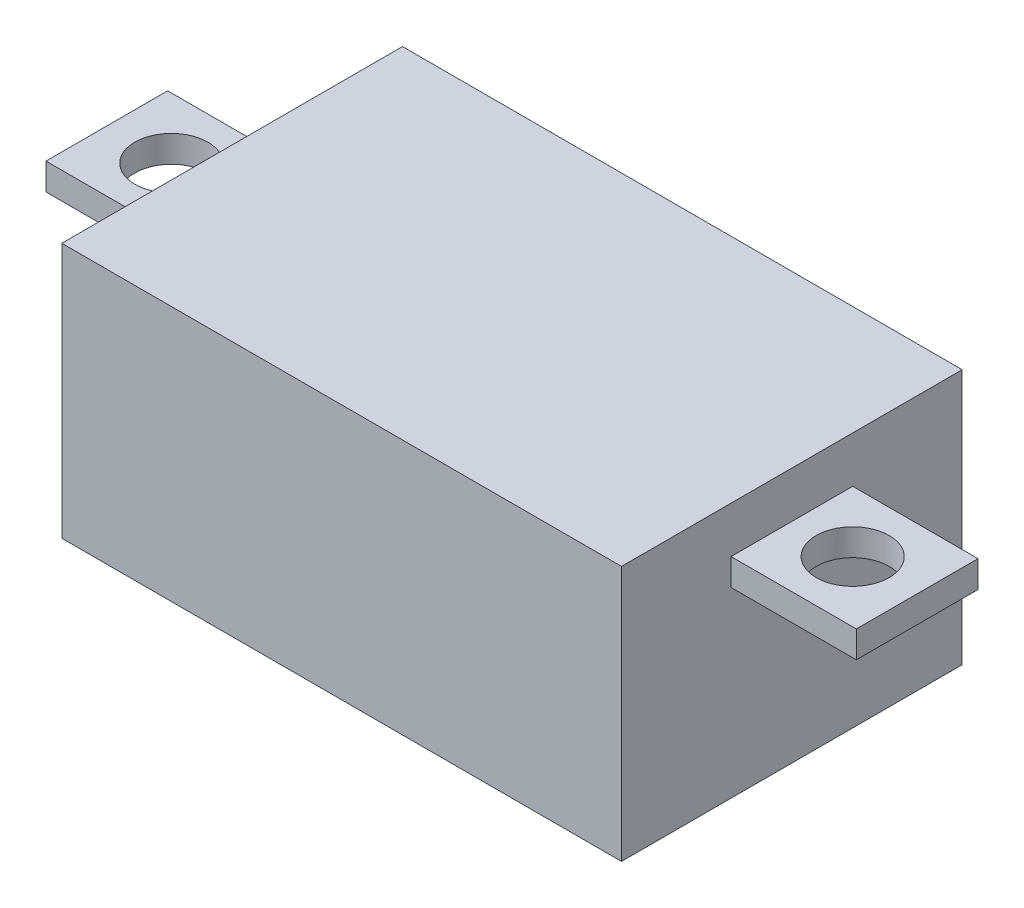
from build123d import *

# Parameters (mm, degrees)
SKETCH1_W           = 23
SKETCH1_H           = 5
SKETCH1_H_2         = 4.5
BOSS_EXTRUDE1_DEPTH = 3
SKETCH1_3_W         = 5.15
SKETCH1_3_H         = 5
BOSS_EXTRUDE2_DEPTH = 1.1
SKETCH1_4_W         = 23
SKETCH1_4_H         = 4.5
SKETCH1_4_H_2       = 5
BOSS_EXTRUDE3_DEPTH = 7.5
CUT_EXTRUDE1_DEPTH  = 0.1
SKETCH3_R           = 0.75
BOSS_EXTRUDE4_DEPTH = 3
SKETCH4_R           = 1.5
CUT_EXTRUDE2_DEPTH  = 3


with BuildPart() as part:
    # Sketch1 → Boss-Extrude1 (new body)
    with BuildSketch(Plane(origin=(0, 0, 0), x_dir=(1, 0, 0), z_dir=(0, 1, 0))):
        Rectangle(SKETCH1_W, SKETCH1_H)
        with Locations((0, 4.75)):
            Rectangle(SKETCH1_W, SKETCH1_H_2)
        with Locations((0, -4.75)):
            Rectangle(SKETCH1_W, SKETCH1_H_2)
    extrude(amount=BOSS_EXTRUDE1_DEPTH)

    # Sketch1<3> → Boss-Extrude2 (add)
    with BuildSketch(Plane(origin=(0, 0, 0), x_dir=(1, 0, 0), z_dir=(0, 1, 0))):
        with Locations((-14.075, 0)):
            Rectangle(SKETCH1_3_W, SKETCH1_3_H)
        with Locations((14.075, 0)):
            Rectangle(SKETCH1_3_W, SKETCH1_3_H)
    extrude(amount=BOSS_EXTRUDE2_DEPTH)

    # Sketch1<4> → Boss-Extrude3 (add)
    with BuildSketch(Plane(origin=(0, 0, 0), x_dir=(1, 0, 0), z_dir=(0, 1, 0))):
        with Locations((0, 4.75)):
            Rectangle(SKETCH1_4_W, SKETCH1_4_H)
        Rectangle(SKETCH1_4_W, SKETCH1_4_H_2)
        with Locations((0, -4.75)):
            Rectangle(SKETCH1_4_W, SKETCH1_4_H)
    extrude(amount=-BOSS_EXTRUDE3_DEPTH)

    # Sketch2 → Cut-Extrude1 (cut)
    # profile 1 of 6: a face of its own
    with BuildSketch(Plane.XZ.offset(7.5)):
        with BuildLine():
            add(Edge.make_bspline(
                [(-9.292089882, 0.353910669), (-9.369966013, 0.418740361), (-9.523854163, 0.546847925), (-9.726005835, 0.768331915), (-9.894228996, 1.014337533), (-10.034938928, 1.281771944), (-10.141747182, 1.57347794), (-10.216215029, 1.88822002), (-10.263993349, 2.225824651), (-10.268607907, 2.459260528), (-10.270985986, 2.579560019)],
                knots=[0, 0, 0, 0, 0.962321305, 1.901607647, 2.838895944, 3.787827236, 4.766613298, 5.782633764, 6.857296347, 8, 8, 8, 8], degree=3))
            add(Edge.make_bspline(
                [(-10.270985986, 2.579560019), (-10.268752451, 2.677092318), (-10.264306852, 2.871219344), (-10.225007942, 3.160813926), (-10.168050446, 3.447821175), (-10.084685938, 3.731316518), (-9.975826887, 4.010807629), (-9.845231621, 4.288206544), (-9.687278834, 4.560976048), (-9.512624597, 4.829289299), (-9.317660862, 5.081544377), (-9.095375456, 5.300124741), (-8.854960944, 5.487655154), (-8.594740858, 5.64083173), (-8.314904661, 5.760138762), (-8.015691699, 5.841163516), (-7.697392905, 5.894484769), (-7.478191122, 5.900396619), (-7.365953518, 5.903423656)],
                knots=[0, 0, 0, 0, 0.95272502, 1.896291562, 2.851490125, 3.810370635, 4.779693931, 5.780320533, 6.803581294, 7.857439095, 8.908007786, 9.912055773, 10.895812754, 11.88078429, 12.854673399, 13.859316582, 14.903908662, 16, 16, 16, 16], degree=3))
            add(Edge.make_bspline(
                [(-7.365953518, 5.903423656), (-7.268424733, 5.901310819), (-7.07661239, 5.89715545), (-6.796555544, 5.857824646), (-6.530844527, 5.791306852), (-6.278993715, 5.7004596), (-6.038253428, 5.587756922), (-5.816157777, 5.440585665), (-5.605711134, 5.272819807), (-5.411152916, 5.079760257), (-5.234518689, 4.867264296), (-5.080026687, 4.637247126), (-4.950691729, 4.391174638), (-4.84159923, 4.130343567), (-4.764305613, 3.850653711), (-4.700938952, 3.558449997), (-4.668099435, 3.249137224), (-4.66313761, 3.03822803), (-4.660596375, 2.93020937)],
                knots=[0, 0, 0, 0, 1.036327342, 2.038171339, 2.998737472, 3.943083592, 4.880902852, 5.81669551, 6.768071647, 7.73820126, 8.724768468, 9.701170866, 10.677725755, 11.675996246, 12.700037544, 13.757698046, 14.851588941, 16, 16, 16, 16], degree=3))
            add(Edge.make_bspline(
                [(-4.660596375, 2.93020937), (-4.665470786, 2.780489587), (-4.674976547, 2.488515702), (-4.757324951, 2.063537964), (-4.89447939, 1.667296122), (-5.082530207, 1.297130247), (-5.328381699, 0.960936756), (-5.630684816, 0.661021941), (-5.986032054, 0.39490834), (-6.254142647, 0.255235492), (-6.391927544, 0.183456123)],
                knots=[0, 0, 0, 0, 1.043187573, 2.034357272, 3.004410992, 3.958635752, 4.918549635, 5.894987737, 6.918211712, 8, 8, 8, 8], degree=3))
            add(Edge.make_bspline(
                [(-6.391927544, 0.183456123), (-6.285937579, 0.104779005), (-6.081203282, -0.047196744), (-5.816885683, -0.309430836), (-5.593790941, -0.581435195), (-5.421552611, -0.875078918), (-5.287488757, -1.185580691), (-5.196036753, -1.520885566), (-5.139141593, -1.879536562), (-5.131858792, -2.127200615), (-5.128128843, -2.254043877)],
                knots=[0, 0, 0, 0, 1.103169462, 2.130924592, 3.10674262, 4.038553697, 4.969572418, 5.928607489, 6.939118624, 8, 8, 8, 8], degree=3))
            add(Edge.make_bspline(
                [(-5.128128843, -2.254043877), (-5.130355964, -2.403550426), (-5.134725946, -2.696907156), (-5.186050384, -3.125704286), (-5.262085668, -3.534190074), (-5.372461008, -3.92127166), (-5.513332249, -4.287705959), (-5.686932358, -4.632833952), (-5.89237694, -4.955990461), (-6.127617552, -5.253654803), (-6.384886287, -5.522044868), (-6.654122961, -5.760601127), (-6.939615466, -5.958623163), (-7.235521083, -6.124238977), (-7.546402361, -6.251408264), (-7.87020702, -6.340615142), (-8.206289822, -6.400276635), (-8.435497858, -6.405575347), (-8.551830142, -6.408264656)],
                knots=[0, 0, 0, 0, 1.19522445, 2.345229263, 3.449174291, 4.51575633, 5.559872245, 6.584797786, 7.600593968, 8.617592793, 9.614055066, 10.571096483, 11.489641328, 12.387604148, 13.278569105, 14.168587384, 15.070484547, 16, 16, 16, 16], degree=3))
            add(Edge.make_bspline(
                [(-8.551830142, -6.408264656), (-8.649370913, -6.405324924), (-8.841286195, -6.399540887), (-9.123176641, -6.357766295), (-9.392318373, -6.286556224), (-9.650536122, -6.18844771), (-9.897256434, -6.062279141), (-10.129533278, -5.903368994), (-10.351789984, -5.721386358), (-10.558415405, -5.511115257), (-10.746653273, -5.280059081), (-10.911989362, -5.028988124), (-11.049658856, -4.760591697), (-11.166322714, -4.476127145), (-11.252281165, -4.173526876), (-11.315568599, -3.855173241), (-11.355948105, -3.520501425), (-11.359884116, -3.291498911), (-11.361895077, -3.174498422)],
                knots=[0, 0, 0, 0, 0.976828073, 1.921947418, 2.846812991, 3.760316856, 4.683895112, 5.615170581, 6.573899456, 7.556966719, 8.56260179, 9.554771102, 10.562015217, 11.579574908, 12.629331345, 13.707172389, 14.82856329, 16, 16, 16, 16], degree=3))
            add(Edge.make_bspline(
                [(-11.361895077, -3.174498422), (-11.358893619, -3.031461926), (-11.352937357, -2.747612272), (-11.297032141, -2.328974804), (-11.210495445, -1.921892631), (-11.086330829, -1.533962239), (-10.937672241, -1.172477772), (-10.769387226, -0.846264631), (-10.585879547, -0.559575103), (-10.380228347, -0.312658624), (-10.148392525, -0.101660076), (-9.890372792, 0.079766689), (-9.604184289, 0.236926715), (-9.397917662, 0.314242697), (-9.292089882, 0.353910669)],
                knots=[0, 0, 0, 0, 1.176834195, 2.335375853, 3.470249067, 4.598613457, 5.683040259, 6.684117428, 7.61626911, 8.479421649, 9.321209342, 10.188772394, 11.070726076, 12, 12, 12, 12], degree=3))
        make_face()
        with BuildLine():
            add(Edge.make_bspline(
                [(-9.024232739, 2.557644435), (-9.019984778, 2.424155755), (-9.011939068, 2.171325914), (-8.940523924, 1.813653337), (-8.82366826, 1.499545993), (-8.652934158, 1.235848533), (-8.445929006, 1.02189069), (-8.199893544, 0.869744979), (-7.922960018, 0.775223416), (-7.727109054, 0.765540419), (-7.626505466, 0.760566513)],
                knots=[0, 0, 0, 0, 1.249965187, 2.367455427, 3.403040823, 4.37163023, 5.291522028, 6.169698539, 7.059821352, 8, 8, 8, 8], degree=3))
            add(Edge.make_bspline(
                [(-7.626505466, 0.760566513), (-7.567129982, 0.762415457), (-7.449274454, 0.766085462), (-7.276773622, 0.796006119), (-7.110943797, 0.844298884), (-6.955081049, 0.916574072), (-6.80486254, 1.005239281), (-6.660047764, 1.111766669), (-6.527292784, 1.242912278), (-6.400165164, 1.388781357), (-6.284594653, 1.549865276), (-6.1839886, 1.72465279), (-6.098729246, 1.910584898), (-6.027887222, 2.107538902), (-5.974631047, 2.316450059), (-5.936142929, 2.536229275), (-5.910706551, 2.76727698), (-5.908482015, 2.925270332), (-5.907349622, 3.005696383)],
                knots=[0, 0, 0, 0, 0.90439548, 1.795151793, 2.660108851, 3.529301595, 4.405508313, 5.315974762, 6.260835364, 7.243018857, 8.262584836, 9.276808601, 10.311866317, 11.37615408, 12.462288436, 13.593083084, 14.774766022, 16, 16, 16, 16], degree=3))
            add(Edge.make_bspline(
                [(-5.907349622, 3.005696383), (-5.911492795, 3.138373955), (-5.919367767, 3.390555581), (-5.99277121, 3.748111205), (-6.116283359, 4.061584173), (-6.288884359, 4.327777247), (-6.496428299, 4.544788084), (-6.740411029, 4.700064922), (-7.012898579, 4.798549283), (-7.20601132, 4.807779516), (-7.305076895, 4.812514565)],
                knots=[0, 0, 0, 0, 1.242877275, 2.362349616, 3.403932345, 4.383439229, 5.319896184, 6.196053275, 7.074587107, 8, 8, 8, 8], degree=3))
            add(Edge.make_bspline(
                [(-7.305076895, 4.812514565), (-7.381744872, 4.809652479), (-7.532981132, 4.80400669), (-7.7543054, 4.745917659), (-7.966718924, 4.659206521), (-8.167822417, 4.53564359), (-8.35451273, 4.379124479), (-8.51977347, 4.185715298), (-8.670210064, 3.96306034), (-8.793447641, 3.708657074), (-8.89429768, 3.435989181), (-8.97157572, 3.152027575), (-9.015873736, 2.857749793), (-9.021425279, 2.658438029), (-9.024232739, 2.557644435)],
                knots=[0, 0, 0, 0, 0.87561259, 1.727244921, 2.601871461, 3.494031832, 4.416998155, 5.378250612, 6.395927924, 7.484363514, 8.604216258, 9.719590807, 10.846778364, 12, 12, 12, 12], degree=3))
        make_face(mode=Mode.SUBTRACT)
        with BuildLine():
            add(Edge.make_bspline(
                [(-10.11514183, -3.340082838), (-10.113718962, -3.412364525), (-10.110930355, -3.554025768), (-10.089641083, -3.762001329), (-10.049440816, -3.958479451), (-10.000173371, -4.145346884), (-9.930452741, -4.31922606), (-9.84760194, -4.483190233), (-9.750355866, -4.637000459), (-9.638448916, -4.778148602), (-9.514689571, -4.904099519), (-9.382689089, -5.014400209), (-9.242830929, -5.108670297), (-9.093101645, -5.183008521), (-8.937520854, -5.246008366), (-8.772412583, -5.285297823), (-8.600782171, -5.314894456), (-8.482976103, -5.3165232), (-8.4227717, -5.317355565)],
                knots=[0, 0, 0, 0, 1.188472519, 2.329227527, 3.431145324, 4.483453595, 5.502046191, 6.50477738, 7.500735689, 8.488703579, 9.46076844, 10.398891858, 11.313168927, 12.226373873, 13.143374327, 14.065893971, 15.011581498, 16, 16, 16, 16], degree=3))
            add(Edge.make_bspline(
                [(-8.4227717, -5.317355565), (-8.347855682, -5.314791006), (-8.199785048, -5.309722184), (-7.983629307, -5.261968453), (-7.779575528, -5.1832466), (-7.587605666, -5.073932834), (-7.405520613, -4.936785604), (-7.237038614, -4.765659218), (-7.078733545, -4.5655432), (-6.887173538, -4.259600546), (-6.681508579, -3.851096439), (-6.506489083, -3.334541329), (-6.393008715, -2.805255845), (-6.380933471, -2.446170873), (-6.37488209, -2.266219201)],
                knots=[0, 0, 0, 0, 0.666783807, 1.317890398, 1.961238708, 2.608922107, 3.280084467, 3.985816239, 4.742584327, 5.549105806, 7.198637847, 8.804205301, 10.398460966, 12, 12, 12, 12], degree=3))
            add(Edge.make_bspline(
                [(-6.37488209, -2.266219201), (-6.376173023, -2.193913756), (-6.378703058, -2.052205951), (-6.401729445, -1.8456549), (-6.434818783, -1.650024696), (-6.482757664, -1.465951776), (-6.54946261, -1.295467735), (-6.628156446, -1.136113018), (-6.717318678, -0.98566542), (-6.824704337, -0.850665593), (-6.941929739, -0.730141669), (-7.062540323, -0.619697109), (-7.19724262, -0.533752251), (-7.334406589, -0.455665244), (-7.48230974, -0.401488104), (-7.634990065, -0.358325848), (-7.796172151, -0.333945899), (-7.90646122, -0.331557238), (-7.962544427, -0.330342578)],
                knots=[0, 0, 0, 0, 1.235243386, 2.420891397, 3.54745643, 4.624155825, 5.664870234, 6.669842854, 7.659477372, 8.647360494, 9.608789992, 10.532661795, 11.432905565, 12.332935577, 13.224265291, 14.116026642, 15.041978771, 16, 16, 16, 16], degree=3))
            add(Edge.make_bspline(
                [(-7.962544427, -0.330342578), (-8.034966148, -0.332406726), (-8.177658586, -0.336473716), (-8.388098695, -0.377330005), (-8.589281695, -0.443680862), (-8.785964635, -0.531849606), (-8.972225277, -0.649708186), (-9.152003173, -0.792436914), (-9.321771935, -0.961973378), (-9.484748859, -1.152972384), (-9.632449399, -1.366634092), (-9.762045672, -1.599073831), (-9.870862051, -1.84809746), (-9.962906268, -2.113014797), (-10.028558115, -2.396677242), (-10.080918771, -2.695597088), (-10.109751133, -3.012405933), (-10.113311539, -3.228827469), (-10.11514183, -3.340082838)],
                knots=[0, 0, 0, 0, 0.845026475, 1.66495475, 2.492356661, 3.315348054, 4.175499836, 5.059354536, 5.991121003, 6.973085749, 7.988125535, 9.019370445, 10.076222338, 11.158449011, 12.289679313, 13.472558368, 14.700723345, 16, 16, 16, 16], degree=3))
        make_face(mode=Mode.SUBTRACT)
    # profile 2 of 6: a face of its own
    with BuildSketch(Plane.XZ.offset(7.5)):
        Polygon((-5.812284687, -6.2524205), (-5.551732739, -4.538134786), (-4.275758713, -4.538134786), (-4.56553144, -6.2524205), align=None)
    # profile 3 of 6: a face of its own
    with BuildSketch(Plane.XZ.offset(7.5)):
        with BuildLine():
            add(Edge.make_bspline(
                [(-1.621440531, 0.353910669), (-1.699316662, 0.418740361), (-1.853204813, 0.546847925), (-2.055356485, 0.768331915), (-2.223579645, 1.014337533), (-2.364289577, 1.281771944), (-2.471097832, 1.57347794), (-2.545565678, 1.88822002), (-2.593343998, 2.225824651), (-2.597958556, 2.459260528), (-2.600336635, 2.579560019)],
                knots=[0, 0, 0, 0, 0.962321305, 1.901607647, 2.838895944, 3.787827236, 4.766613298, 5.782633764, 6.857296347, 8, 8, 8, 8], degree=3))
            add(Edge.make_bspline(
                [(-2.600336635, 2.579560019), (-2.5981031, 2.677092318), (-2.593657501, 2.871219344), (-2.554358592, 3.160813926), (-2.497401096, 3.447821175), (-2.414036587, 3.731316518), (-2.305177536, 4.010807629), (-2.17458227, 4.288206544), (-2.016629484, 4.560976048), (-1.841975247, 4.829289299), (-1.647011511, 5.081544377), (-1.424726105, 5.300124741), (-1.184311594, 5.487655154), (-0.924091507, 5.64083173), (-0.64425531, 5.760138762), (-0.345042348, 5.841163516), (-0.026743555, 5.894484769), (0.192458229, 5.900396619), (0.304695832, 5.903423656)],
                knots=[0, 0, 0, 0, 0.95272502, 1.896291562, 2.851490125, 3.810370635, 4.779693931, 5.780320533, 6.803581294, 7.857439095, 8.908007786, 9.912055773, 10.895812754, 11.88078429, 12.854673399, 13.859316582, 14.903908662, 16, 16, 16, 16], degree=3))
            add(Edge.make_bspline(
                [(0.304695832, 5.903423656), (0.402224618, 5.901310819), (0.594036961, 5.89715545), (0.874093806, 5.857824646), (1.139804824, 5.791306852), (1.391655636, 5.7004596), (1.632395922, 5.587756922), (1.854491574, 5.440585665), (2.064938217, 5.272819807), (2.259496434, 5.079760257), (2.436130662, 4.867264296), (2.590622664, 4.637247126), (2.719957621, 4.391174638), (2.829050121, 4.130343567), (2.906343737, 3.850653711), (2.969710399, 3.558449997), (3.002549916, 3.249137224), (3.007511741, 3.03822803), (3.010052975, 2.93020937)],
                knots=[0, 0, 0, 0, 1.036327342, 2.038171339, 2.998737472, 3.943083592, 4.880902852, 5.81669551, 6.768071647, 7.73820126, 8.724768468, 9.701170866, 10.677725755, 11.675996246, 12.700037544, 13.757698046, 14.851588941, 16, 16, 16, 16], degree=3))
            add(Edge.make_bspline(
                [(3.010052975, 2.93020937), (3.005178565, 2.780489587), (2.995672804, 2.488515702), (2.9133244, 2.063537964), (2.77616996, 1.667296122), (2.588119144, 1.297130247), (2.342267652, 0.960936756), (2.039964534, 0.661021941), (1.684617297, 0.39490834), (1.416506704, 0.255235492), (1.278721806, 0.183456123)],
                knots=[0, 0, 0, 0, 1.043187573, 2.034357272, 3.004410992, 3.958635752, 4.918549635, 5.894987737, 6.918211712, 8, 8, 8, 8], degree=3))
            add(Edge.make_bspline(
                [(1.278721806, 0.183456123), (1.384711772, 0.104779005), (1.589446068, -0.047196744), (1.853763668, -0.309430836), (2.07685841, -0.581435195), (2.249096739, -0.875078918), (2.383160593, -1.185580691), (2.474612597, -1.520885566), (2.531507758, -1.879536562), (2.538790559, -2.127200615), (2.542520508, -2.254043877)],
                knots=[0, 0, 0, 0, 1.103169462, 2.130924592, 3.10674262, 4.038553697, 4.969572418, 5.928607489, 6.939118624, 8, 8, 8, 8], degree=3))
            add(Edge.make_bspline(
                [(2.542520508, -2.254043877), (2.540293387, -2.403550426), (2.535923405, -2.696907156), (2.484598967, -3.125704286), (2.408563683, -3.534190074), (2.298188342, -3.92127166), (2.157317102, -4.287705959), (1.983716992, -4.632833952), (1.778272411, -4.955990461), (1.543031799, -5.253654803), (1.285763064, -5.522044868), (1.016526389, -5.760601127), (0.731033885, -5.958623163), (0.435128268, -6.124238977), (0.12424699, -6.251408264), (-0.199557669, -6.340615142), (-0.535640471, -6.400276635), (-0.764848507, -6.405575347), (-0.881180791, -6.408264656)],
                knots=[0, 0, 0, 0, 1.19522445, 2.345229263, 3.449174291, 4.51575633, 5.559872245, 6.584797786, 7.600593968, 8.617592793, 9.614055066, 10.571096483, 11.489641328, 12.387604148, 13.278569105, 14.168587384, 15.070484547, 16, 16, 16, 16], degree=3))
            add(Edge.make_bspline(
                [(-0.881180791, -6.408264656), (-0.978721563, -6.405324924), (-1.170636844, -6.399540887), (-1.452527291, -6.357766295), (-1.721669023, -6.286556224), (-1.979886772, -6.18844771), (-2.226607084, -6.062279141), (-2.458883928, -5.903368994), (-2.681140633, -5.721386358), (-2.887766054, -5.511115257), (-3.076003923, -5.280059081), (-3.241340011, -5.028988124), (-3.379009505, -4.760591697), (-3.495673363, -4.476127145), (-3.581631814, -4.173526876), (-3.644919248, -3.855173241), (-3.685298754, -3.520501425), (-3.689234765, -3.291498911), (-3.691245726, -3.174498422)],
                knots=[0, 0, 0, 0, 0.976828073, 1.921947418, 2.846812991, 3.760316856, 4.683895112, 5.615170581, 6.573899456, 7.556966719, 8.56260179, 9.554771102, 10.562015217, 11.579574908, 12.629331345, 13.707172389, 14.82856329, 16, 16, 16, 16], degree=3))
            add(Edge.make_bspline(
                [(-3.691245726, -3.174498422), (-3.688244268, -3.031461926), (-3.682288007, -2.747612272), (-3.62638279, -2.328974804), (-3.539846095, -1.921892631), (-3.415681478, -1.533962239), (-3.26702289, -1.172477772), (-3.098737876, -0.846264631), (-2.915230197, -0.559575103), (-2.709578996, -0.312658624), (-2.477743174, -0.101660076), (-2.219723441, 0.079766689), (-1.933534938, 0.236926715), (-1.727268312, 0.314242697), (-1.621440531, 0.353910669)],
                knots=[0, 0, 0, 0, 1.176834195, 2.335375853, 3.470249067, 4.598613457, 5.683040259, 6.684117428, 7.61626911, 8.479421649, 9.321209342, 10.188772394, 11.070726076, 12, 12, 12, 12], degree=3))
        make_face()
        with BuildLine():
            add(Edge.make_bspline(
                [(-1.353583388, 2.557644435), (-1.349335428, 2.424155755), (-1.341289717, 2.171325914), (-1.269874573, 1.813653337), (-1.15301891, 1.499545993), (-0.982284808, 1.235848533), (-0.775279655, 1.02189069), (-0.529244193, 0.869744979), (-0.252310667, 0.775223416), (-0.056459704, 0.765540419), (0.044143884, 0.760566513)],
                knots=[0, 0, 0, 0, 1.249965187, 2.367455427, 3.403040823, 4.37163023, 5.291522028, 6.169698539, 7.059821352, 8, 8, 8, 8], degree=3))
            add(Edge.make_bspline(
                [(0.044143884, 0.760566513), (0.103519369, 0.762415457), (0.221374897, 0.766085462), (0.393875729, 0.796006119), (0.559705553, 0.844298884), (0.715568301, 0.916574072), (0.865786811, 1.005239281), (1.010601587, 1.111766669), (1.143356567, 1.242912278), (1.270484187, 1.388781357), (1.386054698, 1.549865276), (1.486660751, 1.72465279), (1.571920104, 1.910584898), (1.642762129, 2.107538902), (1.696018303, 2.316450059), (1.734506421, 2.536229275), (1.7599428, 2.76727698), (1.762167335, 2.925270332), (1.763299729, 3.005696383)],
                knots=[0, 0, 0, 0, 0.90439548, 1.795151793, 2.660108851, 3.529301595, 4.405508313, 5.315974762, 6.260835364, 7.243018857, 8.262584836, 9.276808601, 10.311866317, 11.37615408, 12.462288436, 13.593083084, 14.774766022, 16, 16, 16, 16], degree=3))
            add(Edge.make_bspline(
                [(1.763299729, 3.005696383), (1.759156555, 3.138373955), (1.751281584, 3.390555581), (1.677878141, 3.748111205), (1.554365991, 4.061584173), (1.381764991, 4.327777247), (1.174221052, 4.544788084), (0.930238322, 4.700064922), (0.657750772, 4.798549283), (0.464638031, 4.807779516), (0.365572456, 4.812514565)],
                knots=[0, 0, 0, 0, 1.242877275, 2.362349616, 3.403932345, 4.383439229, 5.319896184, 6.196053275, 7.074587107, 8, 8, 8, 8], degree=3))
            add(Edge.make_bspline(
                [(0.365572456, 4.812514565), (0.288904479, 4.809652479), (0.137668218, 4.80400669), (-0.083656049, 4.745917659), (-0.296069573, 4.659206521), (-0.497173067, 4.53564359), (-0.683863379, 4.379124479), (-0.84912412, 4.185715298), (-0.999560713, 3.96306034), (-1.122798291, 3.708657074), (-1.223648329, 3.435989181), (-1.300926369, 3.152027575), (-1.345224386, 2.857749793), (-1.350775928, 2.658438029), (-1.353583388, 2.557644435)],
                knots=[0, 0, 0, 0, 0.87561259, 1.727244921, 2.601871461, 3.494031832, 4.416998155, 5.378250612, 6.395927924, 7.484363514, 8.604216258, 9.719590807, 10.846778364, 12, 12, 12, 12], degree=3))
        make_face(mode=Mode.SUBTRACT)
        with BuildLine():
            add(Edge.make_bspline(
                [(-2.444492479, -3.340082838), (-2.443069612, -3.412364525), (-2.440281005, -3.554025768), (-2.418991732, -3.762001329), (-2.378791466, -3.958479451), (-2.329524021, -4.145346884), (-2.259803391, -4.31922606), (-2.176952589, -4.483190233), (-2.079706516, -4.637000459), (-1.967799565, -4.778148602), (-1.84404022, -4.904099519), (-1.712039738, -5.014400209), (-1.572181578, -5.108670297), (-1.422452295, -5.183008521), (-1.266871503, -5.246008366), (-1.101763232, -5.285297823), (-0.930132821, -5.314894456), (-0.812326752, -5.3165232), (-0.752122349, -5.317355565)],
                knots=[0, 0, 0, 0, 1.188472519, 2.329227527, 3.431145324, 4.483453595, 5.502046191, 6.50477738, 7.500735689, 8.488703579, 9.46076844, 10.398891858, 11.313168927, 12.226373873, 13.143374327, 14.065893971, 15.011581498, 16, 16, 16, 16], degree=3))
            add(Edge.make_bspline(
                [(-0.752122349, -5.317355565), (-0.677206331, -5.314791006), (-0.529135698, -5.309722184), (-0.312979957, -5.261968453), (-0.108926178, -5.1832466), (0.083043685, -5.073932834), (0.265128737, -4.936785604), (0.433610737, -4.765659218), (0.591915806, -4.5655432), (0.783475813, -4.259600546), (0.989140771, -3.851096439), (1.164160268, -3.334541329), (1.277640635, -2.805255845), (1.289715879, -2.446170873), (1.295767261, -2.266219201)],
                knots=[0, 0, 0, 0, 0.666783807, 1.317890398, 1.961238708, 2.608922107, 3.280084467, 3.985816239, 4.742584327, 5.549105806, 7.198637847, 8.804205301, 10.398460966, 12, 12, 12, 12], degree=3))
            add(Edge.make_bspline(
                [(1.295767261, -2.266219201), (1.294476328, -2.193913756), (1.291946293, -2.052205951), (1.268919905, -1.8456549), (1.235830568, -1.650024696), (1.187891687, -1.465951776), (1.121186741, -1.295467735), (1.042492905, -1.136113018), (0.953330673, -0.98566542), (0.845945014, -0.850665593), (0.728719611, -0.730141669), (0.608109027, -0.619697109), (0.473406731, -0.533752251), (0.336242761, -0.455665244), (0.188339611, -0.401488104), (0.035659286, -0.358325848), (-0.1255228, -0.333945899), (-0.235811869, -0.331557238), (-0.291895077, -0.330342578)],
                knots=[0, 0, 0, 0, 1.235243386, 2.420891397, 3.54745643, 4.624155825, 5.664870234, 6.669842854, 7.659477372, 8.647360494, 9.608789992, 10.532661795, 11.432905565, 12.332935577, 13.224265291, 14.116026642, 15.041978771, 16, 16, 16, 16], degree=3))
            add(Edge.make_bspline(
                [(-0.291895077, -0.330342578), (-0.364316797, -0.332406726), (-0.507009235, -0.336473716), (-0.717449344, -0.377330005), (-0.918632345, -0.443680862), (-1.115315284, -0.531849606), (-1.301575927, -0.649708186), (-1.481353822, -0.792436914), (-1.651122585, -0.961973378), (-1.814099508, -1.152972384), (-1.961800048, -1.366634092), (-2.091396322, -1.599073831), (-2.2002127, -1.84809746), (-2.292256917, -2.113014797), (-2.357908765, -2.396677242), (-2.41026942, -2.695597088), (-2.439101782, -3.012405933), (-2.442662189, -3.228827469), (-2.444492479, -3.340082838)],
                knots=[0, 0, 0, 0, 0.845026475, 1.66495475, 2.492356661, 3.315348054, 4.175499836, 5.059354536, 5.991121003, 6.973085749, 7.988125535, 9.019370445, 10.076222338, 11.158449011, 12.289679313, 13.472558368, 14.700723345, 16, 16, 16, 16], degree=3))
        make_face(mode=Mode.SUBTRACT)
    # profile 4 of 6: a face of its own
    with BuildSketch(Plane.XZ.offset(7.5)):
        Polygon((1.858364664, -6.2524205), (2.118916612, -4.538134786), (3.394890638, -4.538134786), (3.10511791, -6.2524205), align=None)
    # profile 5 of 6: a face of its own
    with BuildSketch(Plane.XZ.offset(7.5)):
        with BuildLine():
            add(Edge.make_bspline(
                [(6.049208819, 0.353910669), (5.971332689, 0.418740361), (5.817444538, 0.546847925), (5.615292866, 0.768331915), (5.447069706, 1.014337533), (5.306359773, 1.281771944), (5.199551519, 1.57347794), (5.125083673, 1.88822002), (5.077305352, 2.225824651), (5.072690795, 2.459260528), (5.070312716, 2.579560019)],
                knots=[0, 0, 0, 0, 0.962321305, 1.901607647, 2.838895944, 3.787827236, 4.766613298, 5.782633764, 6.857296347, 8, 8, 8, 8], degree=3))
            add(Edge.make_bspline(
                [(5.070312716, 2.579560019), (5.07254625, 2.677092318), (5.076991849, 2.871219344), (5.116290759, 3.160813926), (5.173248255, 3.447821175), (5.256612764, 3.731316518), (5.365471815, 4.010807629), (5.49606708, 4.288206544), (5.654019867, 4.560976048), (5.828674104, 4.829289299), (6.023637839, 5.081544377), (6.245923245, 5.300124741), (6.486337757, 5.487655154), (6.746557843, 5.64083173), (7.026394041, 5.760138762), (7.325607003, 5.841163516), (7.643905796, 5.894484769), (7.86310758, 5.900396619), (7.975345183, 5.903423656)],
                knots=[0, 0, 0, 0, 0.95272502, 1.896291562, 2.851490125, 3.810370635, 4.779693931, 5.780320533, 6.803581294, 7.857439095, 8.908007786, 9.912055773, 10.895812754, 11.88078429, 12.854673399, 13.859316582, 14.903908662, 16, 16, 16, 16], degree=3))
            add(Edge.make_bspline(
                [(7.975345183, 5.903423656), (8.072873969, 5.901310819), (8.264686312, 5.89715545), (8.544743157, 5.857824646), (8.810454175, 5.791306852), (9.062304987, 5.7004596), (9.303045273, 5.587756922), (9.525140924, 5.440585665), (9.735587568, 5.272819807), (9.930145785, 5.079760257), (10.106780012, 4.867264296), (10.261272014, 4.637247126), (10.390606972, 4.391174638), (10.499699472, 4.130343567), (10.576993088, 3.850653711), (10.640359749, 3.558449997), (10.673199267, 3.249137224), (10.678161092, 3.03822803), (10.680702326, 2.93020937)],
                knots=[0, 0, 0, 0, 1.036327342, 2.038171339, 2.998737472, 3.943083592, 4.880902852, 5.81669551, 6.768071647, 7.73820126, 8.724768468, 9.701170866, 10.677725755, 11.675996246, 12.700037544, 13.757698046, 14.851588941, 16, 16, 16, 16], degree=3))
            add(Edge.make_bspline(
                [(10.680702326, 2.93020937), (10.675827916, 2.780489587), (10.666322155, 2.488515702), (10.58397375, 2.063537964), (10.446819311, 1.667296122), (10.258768495, 1.297130247), (10.012917003, 0.960936756), (9.710613885, 0.661021941), (9.355266647, 0.39490834), (9.087156055, 0.255235492), (8.949371157, 0.183456123)],
                knots=[0, 0, 0, 0, 1.043187573, 2.034357272, 3.004410992, 3.958635752, 4.918549635, 5.894987737, 6.918211712, 8, 8, 8, 8], degree=3))
            add(Edge.make_bspline(
                [(8.949371157, 0.183456123), (9.055361122, 0.104779005), (9.260095419, -0.047196744), (9.524413018, -0.309430836), (9.74750776, -0.581435195), (9.91974609, -0.875078918), (10.053809944, -1.185580691), (10.145261948, -1.520885566), (10.202157108, -1.879536562), (10.20943991, -2.127200615), (10.213169858, -2.254043877)],
                knots=[0, 0, 0, 0, 1.103169462, 2.130924592, 3.10674262, 4.038553697, 4.969572418, 5.928607489, 6.939118624, 8, 8, 8, 8], degree=3))
            add(Edge.make_bspline(
                [(10.213169858, -2.254043877), (10.210942737, -2.403550426), (10.206572756, -2.696907156), (10.155248317, -3.125704286), (10.079213033, -3.534190074), (9.968837693, -3.92127166), (9.827966453, -4.287705959), (9.654366343, -4.632833952), (9.448921761, -4.955990461), (9.213681149, -5.253654803), (8.956412414, -5.522044868), (8.68717574, -5.760601127), (8.401683236, -5.958623163), (8.105777619, -6.124238977), (7.794896341, -6.251408264), (7.471091681, -6.340615142), (7.135008879, -6.400276635), (6.905800843, -6.405575347), (6.78946856, -6.408264656)],
                knots=[0, 0, 0, 0, 1.19522445, 2.345229263, 3.449174291, 4.51575633, 5.559872245, 6.584797786, 7.600593968, 8.617592793, 9.614055066, 10.571096483, 11.489641328, 12.387604148, 13.278569105, 14.168587384, 15.070484547, 16, 16, 16, 16], degree=3))
            add(Edge.make_bspline(
                [(6.78946856, -6.408264656), (6.691927788, -6.405324924), (6.500012506, -6.399540887), (6.21812206, -6.357766295), (5.948980328, -6.286556224), (5.690762579, -6.18844771), (5.444042267, -6.062279141), (5.211765423, -5.903368994), (4.989508718, -5.721386358), (4.782883296, -5.511115257), (4.594645428, -5.280059081), (4.42930934, -5.028988124), (4.291639846, -4.760591697), (4.174975987, -4.476127145), (4.089017536, -4.173526876), (4.025730102, -3.855173241), (3.985350596, -3.520501425), (3.981414586, -3.291498911), (3.979403625, -3.174498422)],
                knots=[0, 0, 0, 0, 0.976828073, 1.921947418, 2.846812991, 3.760316856, 4.683895112, 5.615170581, 6.573899456, 7.556966719, 8.56260179, 9.554771102, 10.562015217, 11.579574908, 12.629331345, 13.707172389, 14.82856329, 16, 16, 16, 16], degree=3))
            add(Edge.make_bspline(
                [(3.979403625, -3.174498422), (3.982405082, -3.031461926), (3.988361344, -2.747612272), (4.044266561, -2.328974804), (4.130803256, -1.921892631), (4.254967872, -1.533962239), (4.40362646, -1.172477772), (4.571911475, -0.846264631), (4.755419154, -0.559575103), (4.961070355, -0.312658624), (5.192906176, -0.101660076), (5.450925909, 0.079766689), (5.737114413, 0.236926715), (5.943381039, 0.314242697), (6.049208819, 0.353910669)],
                knots=[0, 0, 0, 0, 1.176834195, 2.335375853, 3.470249067, 4.598613457, 5.683040259, 6.684117428, 7.61626911, 8.479421649, 9.321209342, 10.188772394, 11.070726076, 12, 12, 12, 12], degree=3))
        make_face()
        with BuildLine():
            add(Edge.make_bspline(
                [(6.317065962, 2.557644435), (6.321313923, 2.424155755), (6.329359633, 2.171325914), (6.400774777, 1.813653337), (6.517630441, 1.499545993), (6.688364543, 1.235848533), (6.895369695, 1.02189069), (7.141405158, 0.869744979), (7.418338683, 0.775223416), (7.614189647, 0.765540419), (7.714793235, 0.760566513)],
                knots=[0, 0, 0, 0, 1.249965187, 2.367455427, 3.403040823, 4.37163023, 5.291522028, 6.169698539, 7.059821352, 8, 8, 8, 8], degree=3))
            add(Edge.make_bspline(
                [(7.714793235, 0.760566513), (7.774168719, 0.762415457), (7.892024247, 0.766085462), (8.064525079, 0.796006119), (8.230354904, 0.844298884), (8.386217652, 0.916574072), (8.536436162, 1.005239281), (8.681250938, 1.111766669), (8.814005918, 1.242912278), (8.941133538, 1.388781357), (9.056704048, 1.549865276), (9.157310101, 1.72465279), (9.242569455, 1.910584898), (9.313411479, 2.107538902), (9.366667654, 2.316450059), (9.405155772, 2.536229275), (9.430592151, 2.76727698), (9.432816686, 2.925270332), (9.433949079, 3.005696383)],
                knots=[0, 0, 0, 0, 0.90439548, 1.795151793, 2.660108851, 3.529301595, 4.405508313, 5.315974762, 6.260835364, 7.243018857, 8.262584836, 9.276808601, 10.311866317, 11.37615408, 12.462288436, 13.593083084, 14.774766022, 16, 16, 16, 16], degree=3))
            add(Edge.make_bspline(
                [(9.433949079, 3.005696383), (9.429805906, 3.138373955), (9.421930934, 3.390555581), (9.348527491, 3.748111205), (9.225015342, 4.061584173), (9.052414342, 4.327777247), (8.844870402, 4.544788084), (8.600887672, 4.700064922), (8.328400122, 4.798549283), (8.135287382, 4.807779516), (8.036221806, 4.812514565)],
                knots=[0, 0, 0, 0, 1.242877275, 2.362349616, 3.403932345, 4.383439229, 5.319896184, 6.196053275, 7.074587107, 8, 8, 8, 8], degree=3))
            add(Edge.make_bspline(
                [(8.036221806, 4.812514565), (7.95955383, 4.809652479), (7.808317569, 4.80400669), (7.586993301, 4.745917659), (7.374579778, 4.659206521), (7.173476284, 4.53564359), (6.986785971, 4.379124479), (6.821525231, 4.185715298), (6.671088637, 3.96306034), (6.54785106, 3.708657074), (6.447001022, 3.435989181), (6.369722981, 3.152027575), (6.325424965, 2.857749793), (6.319873423, 2.658438029), (6.317065962, 2.557644435)],
                knots=[0, 0, 0, 0, 0.87561259, 1.727244921, 2.601871461, 3.494031832, 4.416998155, 5.378250612, 6.395927924, 7.484363514, 8.604216258, 9.719590807, 10.846778364, 12, 12, 12, 12], degree=3))
        make_face(mode=Mode.SUBTRACT)
        with BuildLine():
            add(Edge.make_bspline(
                [(5.226156871, -3.340082838), (5.227579739, -3.412364525), (5.230368346, -3.554025768), (5.251657618, -3.762001329), (5.291857885, -3.958479451), (5.34112533, -4.145346884), (5.41084596, -4.31922606), (5.493696762, -4.483190233), (5.590942835, -4.637000459), (5.702849785, -4.778148602), (5.826609131, -4.904099519), (5.958609613, -5.014400209), (6.098467773, -5.108670297), (6.248197056, -5.183008521), (6.403777847, -5.246008366), (6.568886119, -5.285297823), (6.74051653, -5.314894456), (6.858322599, -5.3165232), (6.918527001, -5.317355565)],
                knots=[0, 0, 0, 0, 1.188472519, 2.329227527, 3.431145324, 4.483453595, 5.502046191, 6.50477738, 7.500735689, 8.488703579, 9.46076844, 10.398891858, 11.313168927, 12.226373873, 13.143374327, 14.065893971, 15.011581498, 16, 16, 16, 16], degree=3))
            add(Edge.make_bspline(
                [(6.918527001, -5.317355565), (6.993443019, -5.314791006), (7.141513653, -5.309722184), (7.357669394, -5.261968453), (7.561723173, -5.1832466), (7.753693036, -5.073932834), (7.935778088, -4.936785604), (8.104260087, -4.765659218), (8.262565157, -4.5655432), (8.454125163, -4.259600546), (8.659790122, -3.851096439), (8.834809619, -3.334541329), (8.948289986, -2.805255845), (8.96036523, -2.446170873), (8.966416612, -2.266219201)],
                knots=[0, 0, 0, 0, 0.666783807, 1.317890398, 1.961238708, 2.608922107, 3.280084467, 3.985816239, 4.742584327, 5.549105806, 7.198637847, 8.804205301, 10.398460966, 12, 12, 12, 12], degree=3))
            add(Edge.make_bspline(
                [(8.966416612, -2.266219201), (8.965125678, -2.193913756), (8.962595643, -2.052205951), (8.939569256, -1.8456549), (8.906479918, -1.650024696), (8.858541038, -1.465951776), (8.791836091, -1.295467735), (8.713142255, -1.136113018), (8.623980023, -0.98566542), (8.516594365, -0.850665593), (8.399368962, -0.730141669), (8.278758378, -0.619697109), (8.144056082, -0.533752251), (8.006892112, -0.455665244), (7.858988961, -0.401488104), (7.706308636, -0.358325848), (7.545126551, -0.333945899), (7.434837482, -0.331557238), (7.378754274, -0.330342578)],
                knots=[0, 0, 0, 0, 1.235243386, 2.420891397, 3.54745643, 4.624155825, 5.664870234, 6.669842854, 7.659477372, 8.647360494, 9.608789992, 10.532661795, 11.432905565, 12.332935577, 13.224265291, 14.116026642, 15.041978771, 16, 16, 16, 16], degree=3))
            add(Edge.make_bspline(
                [(7.378754274, -0.330342578), (7.306332553, -0.332406726), (7.163640115, -0.336473716), (6.953200006, -0.377330005), (6.752017006, -0.443680862), (6.555334067, -0.531849606), (6.369073424, -0.649708186), (6.189295528, -0.792436914), (6.019526766, -0.961973378), (5.856549843, -1.152972384), (5.708849303, -1.366634092), (5.579253029, -1.599073831), (5.470436651, -1.84809746), (5.378392434, -2.113014797), (5.312740586, -2.396677242), (5.260379931, -2.695597088), (5.231547568, -3.012405933), (5.227987162, -3.228827469), (5.226156871, -3.340082838)],
                knots=[0, 0, 0, 0, 0.845026475, 1.66495475, 2.492356661, 3.315348054, 4.175499836, 5.059354536, 5.991121003, 6.973085749, 7.988125535, 9.019370445, 10.076222338, 11.158449011, 12.289679313, 13.472558368, 14.700723345, 16, 16, 16, 16], degree=3))
        make_face(mode=Mode.SUBTRACT)
    # profile 6 of 6: a face of its own
    with BuildSketch(Plane.XZ.offset(7.5)):
        Polygon((9.529014014, -6.2524205), (9.789565962, -4.538134786), (11.065539988, -4.538134786), (10.775767261, -6.2524205), align=None)
    extrude(amount=-CUT_EXTRUDE1_DEPTH, mode=Mode.SUBTRACT)

    # Sketch3 → Boss-Extrude4 (add)
    with BuildSketch(Plane(origin=(0, 0, -7), x_dir=(-1, 0, 0), z_dir=(0, 0, -1))):
        with Locations(Location((0, -0.75, 0), (0, 0, 180))):
            Circle(SKETCH3_R)
        with Locations(Location((-2, -0.75, 0), (0, 0, 180))):
            Circle(SKETCH3_R)
        with Locations(Location((2, -0.75, 0), (0, 0, 180))):
            Circle(SKETCH3_R)
    extrude(amount=BOSS_EXTRUDE4_DEPTH)

    # Sketch4 → Cut-Extrude2 (cut)
    with BuildSketch(Plane.XZ):
        with Locations(Location((14, 0, 0), (0, 0, 270))):
            Circle(SKETCH4_R)
        with Locations(Location((-14, 0, 0), (0, 0, 270))):
            Circle(SKETCH4_R)
    extrude(amount=-CUT_EXTRUDE2_DEPTH, mode=Mode.SUBTRACT)


solid = part.part
